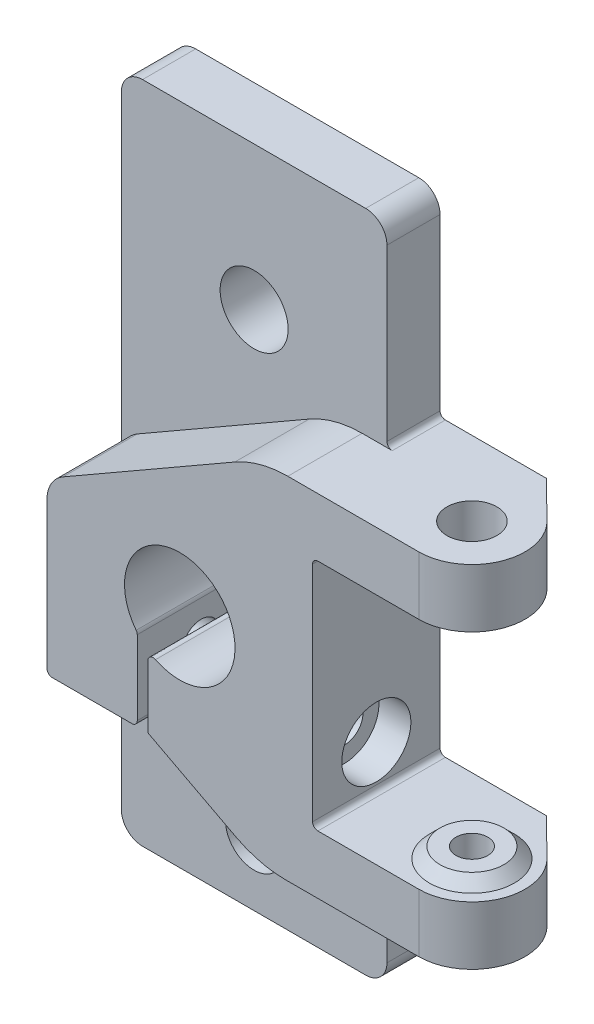
from build123d import *

# Parameters (mm, degrees)
SKETCH1_R                 = 2.7
SKETCH1_R_2               = 3.2
BOSS_EXTRUDE1_DEPTH       = 5
BOSS_EXTRUDE2_REACH       = 40.994
SKETCH3_R                 = 1.5
CUT_EXTRUDE1_DEPTH        = 57.535387148
FILLET1_R                 = 4.999497
FILLET2_R                 = 4.999497
SKETCH4_R                 = 3
BOSS_EXTRUDE3_DEPTH       = 1
DRAFT1_ANGLE              = 45
DRAFT1_OF_MIRROR1_2_ANGLE = 45
SKETCH5_R                 = 1.5
CUT_EXTRUDE2_DEPTH        = 57.535387148
SKETCH6_R                 = 3.1
CUT_EXTRUDE3_DEPTH        = 1.5
FILLET3_R                 = 10
FILLET5_R                 = 0.5
FILLET6_R                 = 2
FILLET7_R                 = 3
SKETCH8_R                 = 3.1
SKETCH8_R_2               = 2.35
BOSS_EXTRUDE4_DEPTH       = 1.5
CUT_EXTRUDE4_START        = -4
SKETCH9_R                 = 2.35
SKETCH9_R_2               = 1.5
CUT_EXTRUDE4_DEPTH        = 4


with BuildPart() as part:
    # Sketch1 → Boss-Extrude1 (new body)
    with BuildSketch(Plane.XY):
        with BuildLine():
            Line((5, -31.25), (5, 31.25))
            Line((5, 31.25), (-20, 31.25))
            Line((-20, 31.25), (-20, -14.75))
            Line((-20, -14.75), (-11.5, -14.75))
            Line((-11.5, -14.75), (-11.5, -7.072649545))
            ThreePointArc((-11.5, -7.072649545), (-3.96959369, 0.06788309), (-10.5, -7.997352116))
            Line((-10.5, -7.997352116), (-10.5, -15.75))
            Line((-10.5, -15.75), (-20, -15.75))
            Line((-20, -15.75), (-20, -31.25))
            Line((-20, -31.25), (5, -31.25))
        make_face()
        with Locations((-7.5, -25.25)):
            Circle(SKETCH1_R, mode=Mode.SUBTRACT)
        with Locations((-7.5, 17.75)):
            Circle(SKETCH1_R_2, mode=Mode.SUBTRACT)
    extrude(amount=BOSS_EXTRUDE1_DEPTH)

    # Boss-Extrude2: up to this face of the body (flat: up to its plane)
    boss_extrude2_end = Plane(part.part.faces().sort_by_distance((4.326854399, 0, 0))[0])
    # Sketch2 → Boss-Extrude2 (add, up to the picked face)
    with BuildSketch(Plane.XY.offset(12), mode=Mode.PRIVATE) as boss_extrude2_sk1:
        with BuildLine():
            Line((0, 12.75), (20, 12.75))
            Line((20, 12.75), (20, 7.25))
            Line((20, 7.25), (5, 7.25))
            Line((5, 7.25), (5, -14.75))
            Line((5, -14.75), (20, -14.75))
            Line((20, -14.75), (20, -20.25))
            Line((20, -20.25), (0, -20.25))
            Line((0, -20.25), (-10.5, -14.75))
            Line((-10.5, -14.75), (-10.5, -7.997352116))
            ThreePointArc((-10.5, -7.997352116), (-3.96959369, 0.06788309), (-11.5, -7.072649545))
            Line((-11.5, -7.072649545), (-11.5, -14.75))
            Line((-11.5, -14.75), (-20, -14.75))
            Line((-20, -14.75), (-20, 1.25))
            Line((-20, 1.25), (0, 12.75))
        make_face()
    boss_extrude2_tool1 = split(extrude(boss_extrude2_sk1.sketch, amount=-BOSS_EXTRUDE2_REACH, mode=Mode.PRIVATE), bisect_by=boss_extrude2_end, keep=Keep.BOTH, mode=Mode.PRIVATE)
    add(boss_extrude2_tool1.solids().sort_by(Axis((-1.249188, -4.122756, 12), (0, 0, -1)))[0])

    # Sketch3 → Cut-Extrude1 (cut, through all)
    with BuildSketch(Plane.XZ.offset(20.25)):
        with Locations(Location((15, 7, 0), (0, 0, 270))):
            Circle(SKETCH3_R)
        Polygon((15, 0), (20, 0), (20, 4.9), align=None)
    extrude(amount=-CUT_EXTRUDE1_DEPTH, mode=Mode.SUBTRACT)

    # Fillet1
    fillet1_edges = [part.edges().sort_by_distance(p)[0] for p in [
        (20, 10, 12),
        (20, 10, 4.9),
    ]]
    fillet(fillet1_edges, radius=FILLET1_R)

    # Fillet2
    fillet2_edges = [part.edges().sort_by_distance(p)[0] for p in [
        (20, -17.5, 12),
        (20, -17.5, 4.9),
    ]]
    fillet(fillet2_edges, radius=FILLET2_R)

    # Sketch4 → Boss-Extrude3 (add)
    with BuildSketch(Plane.XZ.offset(-7.25)):
        with Locations((15, 7)):
            Circle(SKETCH4_R)
    boss_extrude3 = extrude(amount=BOSS_EXTRUDE3_DEPTH)

    # Draft1
    draft1_faces = [part.faces().sort_by_distance(p)[0] for p in [
        (12, 6.75, 7),
    ]]
    draft(draft1_faces, Plane(origin=(15, 6.25, 7), x_dir=(-1, 0, 0), z_dir=(0, -1, 0)), DRAFT1_ANGLE)

    # Mirror1: Boss-Extrude3 across plane
    add(boss_extrude3.mirror(Plane.ZX.offset(-3.75)))

    # Draft1 of Mirror1 2
    draft1_of_mirror1_2_faces = [part.faces().sort_by_distance(p)[0] for p in [
        (12, -14.25, 7),
    ]]
    draft(draft1_of_mirror1_2_faces, Plane(origin=(15, -13.75, 7), x_dir=(-1, 0, 0), z_dir=(0, 1, 0)), DRAFT1_OF_MIRROR1_2_ANGLE)

    # Sketch5 → Cut-Extrude2 (cut, through all)
    with BuildSketch(Plane.XZ.offset(20.25)):
        with Locations(Location((15, 7, 0), (0, 0, 270))):
            Circle(SKETCH5_R)
    extrude(amount=-CUT_EXTRUDE2_DEPTH, mode=Mode.SUBTRACT)

    # Sketch6 → Cut-Extrude3 (cut)
    with BuildSketch(Plane.XZ.offset(20.25)):
        with Locations(Location((15, 7, 0), (0, 0, 270))):
            Circle(SKETCH6_R)
    cut_extrude3 = extrude(amount=-CUT_EXTRUDE3_DEPTH, mode=Mode.SUBTRACT)

    # Mirror2: Cut-Extrude3 across plane
    add(cut_extrude3.mirror(Plane.ZX.offset(-3.75)), mode=Mode.SUBTRACT)

    # Fillet3
    fillet3_edges = [part.edges().sort_by_distance(p)[0] for p in [
        (0, 12.75, 8.5),
        (0, -20.25, 8.5),
    ]]
    fillet(fillet3_edges, radius=FILLET3_R)

    # Fillet5
    fillet5_edges = [part.edges().sort_by_distance(p)[0] for p in [
        (-11.5, -7.072649545, 8.5),
        (-11.5, -14.75, 6),
        (-20, -14.75, 6),
        (-20, -15.75, 2.5),
        (-10.5, -7.997352116, 8.5),
        (5, 7.25, 6),
        (5, 12.75, 2.5),
        (5, -14.75, 6),
        (5, -20.25, 2.5),
    ]]
    fillet(fillet5_edges, radius=FILLET5_R)

    # Fillet6
    fillet6_edges = [part.edges().sort_by_distance(p)[0] for p in [
        (-20, 31.25, 2.5),
        (5, 31.25, 2.5),
        (5, -31.25, 2.5),
        (-20, -31.25, 2.5),
    ]]
    fillet(fillet6_edges, radius=FILLET6_R)

    # Fillet7
    fillet7_edges = [part.edges().sort_by_distance(p)[0] for p in [
        (-20, 1.25, 8.5),
    ]]
    fillet(fillet7_edges, radius=FILLET7_R)

    # Sketch7 → Cut-Revolve3 (revolve, cut)
    with BuildSketch(Plane.XY.offset(6), mode=Mode.PRIVATE) as cut_revolve3_sk:
        Polygon((5, -10.75), (5, -7.5), (2, -7.5), (2, -9), (-15, -9), (-15, -8.4), (-19, -8.4), (-19, -8.25), (-20, -8.25), (-20, -10.75), align=None)
    revolve(cut_revolve3_sk.sketch.rotate(Axis((-28.80218061, -10.75, 6), (1, 0, 0)), 90), axis=Axis((-28.80218061, -10.75, 6), (1, 0, 0)), mode=Mode.SUBTRACT)

    # Sketch8 → Boss-Extrude4 (add)
    with BuildSketch(Plane(origin=(0, 12.75, 0), x_dir=(1, 0, 0), z_dir=(0, 1, 0))):
        with Locations(Location((15, -7, 0), (0, 0, 90))):
            Circle(SKETCH8_R)
        with Locations(Location((15, -7, 0), (0, 0, 270))):
            Circle(SKETCH8_R_2, mode=Mode.SUBTRACT)
    extrude(amount=-BOSS_EXTRUDE4_DEPTH)

    # Sketch9 → Cut-Extrude4 (cut)
    with BuildSketch(Plane(origin=(0, 11.25, 0), x_dir=(1, 0, 0), z_dir=(0, 1, 0)).offset(CUT_EXTRUDE4_START)):
        with Locations(Location((15, -7, 0), (0, 0, 270))):
            Circle(SKETCH9_R)
        with Locations((15, -7)):
            Circle(SKETCH9_R_2, mode=Mode.SUBTRACT)
    extrude(amount=CUT_EXTRUDE4_DEPTH, mode=Mode.SUBTRACT)


solid = part.part
